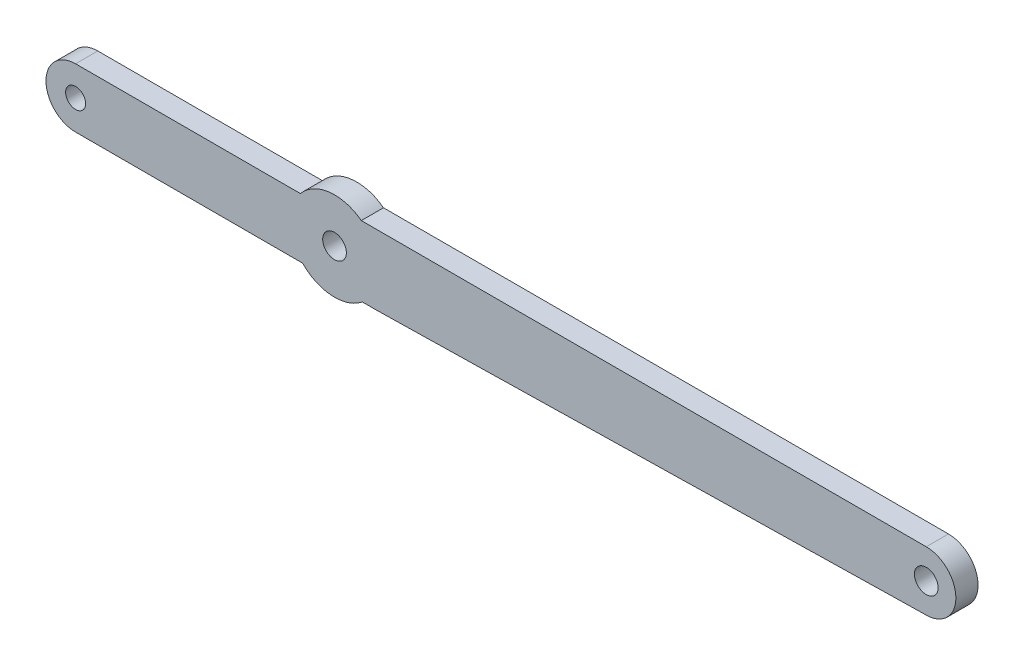
from build123d import *

# Parameters (mm, degrees)
EXTRUDE_1_DEPTH     = 3
SKETCH_2_R          = 1.35
CUT_EXTRUDE_1_DEPTH = 2.444444444
SKETCH_3_R          = 1.6
SKETCH_3_R_2        = 1.35
CUT_EXTRUDE_3_DEPTH = 96.756657889


with BuildPart() as part:
    # 草图1 → 凸台-拉伸1 (new body)
    with BuildSketch(Plane.XY.offset(3)):
        with BuildLine():
            Line((-60.832535173, 7.514094179), (-91.218664305, 7.514094179))
            ThreePointArc((-91.218664305, 7.514094179), (-95.218664305, 3.514094179), (-91.218664305, -0.485905821))
            Line((-91.218664305, -0.485905821), (-60.531573746, -0.485905821))
            ThreePointArc((-60.531573746, -0.485905821), (-56.589491156, -2.306217172), (-52.451603626, -0.990377005))
            Line((-52.451603626, -0.990377005), (-50.420982545, -0.990377005))
            Line((-50.420982545, -0.990377005), (23.816560918, 0.467808699))
            Line((23.816560918, 0.467808699), (23.856567982, 0.468594524))
            ThreePointArc((23.856567982, 0.468594524), (27.777723532, 4.507000717), (23.778016459, 8.467622986))
            Line((23.778016459, 8.467622986), (-52.596358319, 8.467622986))
            ThreePointArc((-52.596358319, 8.467622986), (-56.905640848, 9.642312032), (-60.832535173, 7.514094179))
        make_face()
    extrude(amount=-EXTRUDE_1_DEPTH)

    # 草图2 → 切除-拉伸1 (cut)
    with BuildSketch(Plane.XY.offset(3)):
        with Locations(Location((23.77801746, 4.467622995, 0), (0, 0, 180))):
            Circle(SKETCH_2_R)
    extrude(amount=-CUT_EXTRUDE_1_DEPTH, mode=Mode.SUBTRACT)

    # 草图3 → 切除-拉伸3 (cut, through all)
    with BuildSketch(Plane(origin=(0, 0, 0), x_dir=(-1, 0, 0), z_dir=(0, 0, -1))):
        with Locations(Location((-23.778017455, 4.467823177, 0), (0, 0, 180))):
            Circle(SKETCH_3_R)
        with Locations((56.215610459, 3.6821226)):
            Circle(SKETCH_3_R)
        with Locations((91.218664305, 3.514094179)):
            Circle(SKETCH_3_R_2)
    extrude(amount=-CUT_EXTRUDE_3_DEPTH, mode=Mode.SUBTRACT)


solid = part.part
